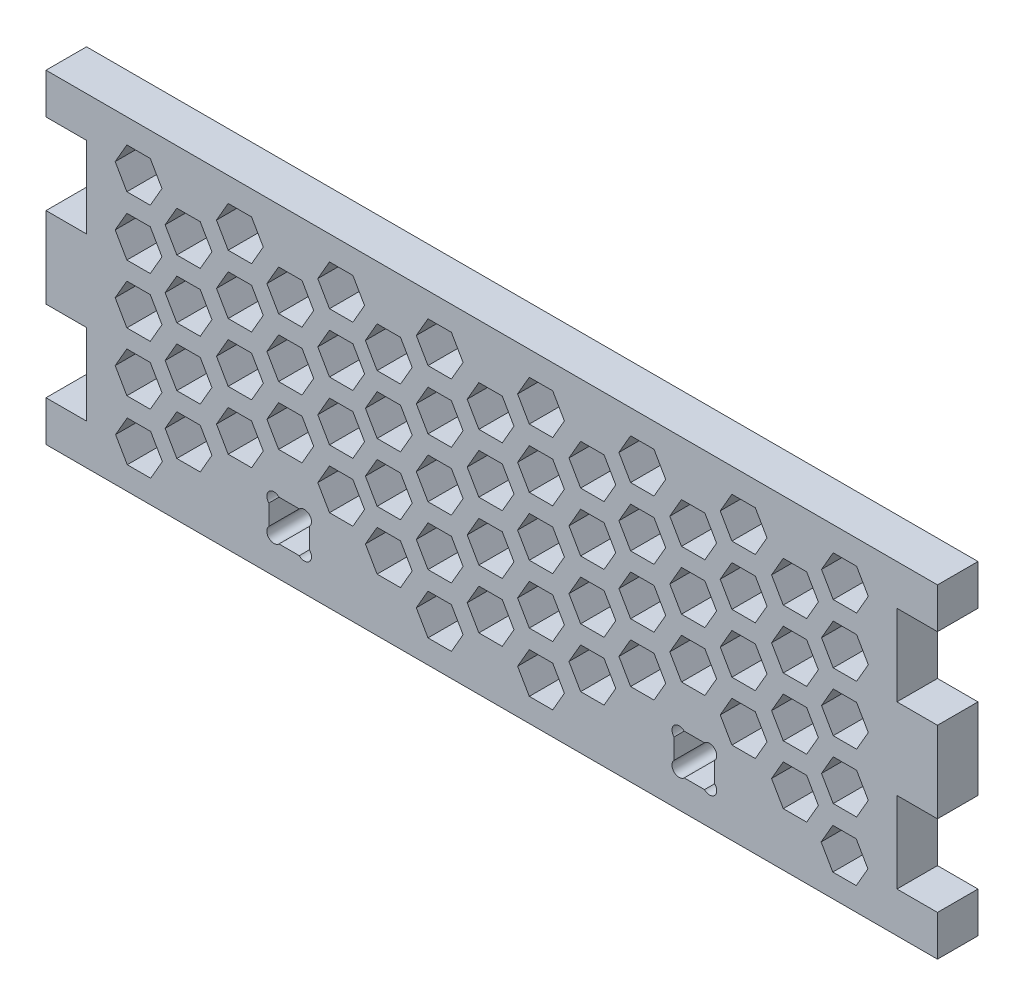
from build123d import *

# Parameters (mm, degrees)
SKETCH2_W                 = 279.4
SKETCH2_H                 = 101.6
RECTANGLE_EXTRUSION_DEPTH = 12.7
SKETCH3_R                 = 2.24536
SKETCH3_W                 = 12.7
SKETCH3_H                 = 12.7
SLOTTING_HOLES_DEPTH      = 12.7
HONEYCOMB_POCKETING_DEPTH = 12.7
SKETCH5_W                 = 12.7
SKETCH5_H                 = 12.7
CUT_EXTRUDE2_DEPTH        = 12.7


with BuildPart() as part:
    # Sketch2 → Rectangle Extrusion (new body)
    with BuildSketch(Plane.XY):
        Rectangle(SKETCH2_W, SKETCH2_H)
    extrude(amount=RECTANGLE_EXTRUSION_DEPTH)

    # Sketch3 → Slotting Holes (cut)
    with BuildSketch(Plane(origin=(0, 0, 0), x_dir=(-1, 0, 0), z_dir=(0, 0, -1))):
        with BuildLine():
            ThreePointArc((-66.674581463, -28.575), (-69.850209282, -28.574790718), (-69.85, -31.750418537))
            Line((-69.85, -31.750418537), (-69.85, -28.575))
            Line((-69.85, -28.575), (-66.674581463, -28.575))
        make_face()
        with BuildLine():
            Line((-69.85, -28.575), (-69.85, -31.750418537))
            ThreePointArc((-69.85, -31.750418537), (-67.403101219, -32.236885515), (-66.01714, -30.1625))
            ThreePointArc((-66.01714, -30.1625), (-66.18800123, -29.303374641), (-66.674581463, -28.575))
            Line((-66.674581463, -28.575), (-69.85, -28.575))
        make_face()
        with Locations((-68.2625, -39.6875)):
            Circle(SKETCH3_R)
        with Locations((-58.7375, -39.6875)):
            Circle(SKETCH3_R)
        with Locations((-58.7375, -30.1625)):
            Circle(SKETCH3_R)
        with Locations((-68.2625, -30.1625)):
            Circle(SKETCH3_R)
        with Locations((-63.5, -34.925)):
            Rectangle(SKETCH3_W, SKETCH3_H)
        with BuildLine():
            ThreePointArc((-60.325418537, -28.575), (-60.325209282, -31.750209282), (-57.15, -31.750418537))
            Line((-57.15, -31.750418537), (-57.15, -28.575))
            Line((-57.15, -28.575), (-60.325418537, -28.575))
        make_face()
        with BuildLine():
            Line((-57.15, -28.575), (-57.15, -31.750418537))
            ThreePointArc((-57.15, -31.750418537), (-56.663114485, -31.021898781), (-56.49214, -30.1625))
            ThreePointArc((-56.49214, -30.1625), (-57.878374641, -28.08800123), (-60.325418537, -28.575))
            Line((-60.325418537, -28.575), (-57.15, -28.575))
        make_face()
        with BuildLine():
            ThreePointArc((-57.15, -38.099581463), (-60.325209282, -38.099790718), (-60.325418537, -41.275))
            Line((-60.325418537, -41.275), (-57.15, -41.275))
            Line((-57.15, -41.275), (-57.15, -38.099581463))
        make_face()
        with BuildLine():
            Line((-57.15, -41.275), (-60.325418537, -41.275))
            ThreePointArc((-60.325418537, -41.275), (-57.878374641, -41.76199877), (-56.49214, -39.6875))
            ThreePointArc((-56.49214, -39.6875), (-56.663114485, -38.828101219), (-57.15, -38.099581463))
            Line((-57.15, -38.099581463), (-57.15, -41.275))
        make_face()
        with BuildLine():
            Line((-69.85, -38.099581463), (-69.85, -41.275))
            Line((-69.85, -41.275), (-66.674581463, -41.275))
            ThreePointArc((-66.674581463, -41.275), (-66.18800123, -40.546625359), (-66.01714, -39.6875))
            ThreePointArc((-66.01714, -39.6875), (-67.403101219, -37.613114485), (-69.85, -38.099581463))
        make_face()
        with BuildLine():
            Line((-66.674581463, -41.275), (-69.85, -41.275))
            Line((-69.85, -41.275), (-69.85, -38.099581463))
            ThreePointArc((-69.85, -38.099581463), (-69.850209282, -41.275209282), (-66.674581463, -41.275))
        make_face()
        with BuildLine():
            ThreePointArc((60.98286, -30.1625), (60.81199877, -29.303374641), (60.325418537, -28.575))
            Line((60.325418537, -28.575), (57.15, -28.575))
            Line((57.15, -28.575), (57.15, -31.750418537))
            ThreePointArc((57.15, -31.750418537), (59.596898781, -32.236885515), (60.98286, -30.1625))
        make_face()
        with BuildLine():
            Line((57.15, -28.575), (60.325418537, -28.575))
            ThreePointArc((60.325418537, -28.575), (57.149790718, -28.574790718), (57.15, -31.750418537))
            Line((57.15, -31.750418537), (57.15, -28.575))
        make_face()
        with Locations((68.2625, -30.1625)):
            Circle(SKETCH3_R)
        with Locations((58.7375, -30.1625)):
            Circle(SKETCH3_R)
        with Locations((58.7375, -39.6875)):
            Circle(SKETCH3_R)
        with Locations((68.2625, -39.6875)):
            Circle(SKETCH3_R)
        with Locations((63.5, -34.925)):
            Rectangle(SKETCH3_W, SKETCH3_H)
        with BuildLine():
            Line((69.85, -31.750418537), (69.85, -28.575))
            Line((69.85, -28.575), (66.674581463, -28.575))
            ThreePointArc((66.674581463, -28.575), (66.674790718, -31.750209282), (69.85, -31.750418537))
        make_face()
        with BuildLine():
            Line((66.674581463, -28.575), (69.85, -28.575))
            Line((69.85, -28.575), (69.85, -31.750418537))
            ThreePointArc((69.85, -31.750418537), (70.336885515, -31.021898781), (70.50786, -30.1625))
            ThreePointArc((70.50786, -30.1625), (69.121625359, -28.08800123), (66.674581463, -28.575))
        make_face()
        with BuildLine():
            ThreePointArc((70.50786, -39.6875), (70.336885515, -38.828101219), (69.85, -38.099581463))
            Line((69.85, -38.099581463), (69.85, -41.275))
            Line((69.85, -41.275), (66.674581463, -41.275))
            ThreePointArc((66.674581463, -41.275), (69.121625359, -41.76199877), (70.50786, -39.6875))
        make_face()
        with BuildLine():
            Line((69.85, -41.275), (69.85, -38.099581463))
            ThreePointArc((69.85, -38.099581463), (66.674790718, -38.099790718), (66.674581463, -41.275))
            Line((66.674581463, -41.275), (69.85, -41.275))
        make_face()
        with BuildLine():
            ThreePointArc((60.98286, -39.6875), (59.596898781, -37.613114485), (57.15, -38.099581463))
            Line((57.15, -38.099581463), (57.15, -41.275))
            Line((57.15, -41.275), (60.325418537, -41.275))
            ThreePointArc((60.325418537, -41.275), (60.81199877, -40.546625359), (60.98286, -39.6875))
        make_face()
        with BuildLine():
            Line((57.15, -41.275), (57.15, -38.099581463))
            ThreePointArc((57.15, -38.099581463), (57.149790718, -41.275209282), (60.325418537, -41.275))
            Line((60.325418537, -41.275), (57.15, -41.275))
        make_face()
    extrude(amount=-SLOTTING_HOLES_DEPTH, mode=Mode.SUBTRACT)

    # Sketch4 → Honeycomb Pocketing (cut)
    with BuildSketch(Plane.XY.offset(12.7)):
        Polygon((6.96765294, 27.501186014), (3.301476978, 33.851185003), (-4.03087144, 33.85118298), (-7.697043898, 27.501181968), (-4.030867936, 21.15118298), (3.301480483, 21.151185003), align=None)
        Polygon((-24.928062682, 27.501186014), (-28.594238643, 33.851185003), (-35.926587062, 33.85118298), (-39.592759519, 27.501181968), (-35.926583558, 21.15118298), (-28.594235139, 21.151185003), align=None)
        Polygon((38.863368561, 27.501186014), (35.1971926, 33.851185003), (27.864844181, 33.85118298), (24.198671724, 27.501181968), (27.864847685, 21.15118298), (35.197196104, 21.151185003), align=None)
        Polygon((-8.980204871, 18.293686014), (-12.646380832, 24.643685003), (-19.978729251, 24.64368298), (-23.644901708, 18.293681968), (-19.978725747, 11.94368298), (-12.646377328, 11.943685003), align=None)
        Polygon((22.769795129, 18.293686014), (19.103619168, 24.643685003), (11.771270749, 24.64368298), (8.105098292, 18.293681968), (11.771274253, 11.94368298), (19.103622672, 11.943685003), align=None)
        Polygon((-24.928062682, 9.086186014), (-28.594238643, 15.436185003), (-35.926587062, 15.43618298), (-39.592759519, 9.086181968), (-35.926583558, 2.73618298), (-28.594235139, 2.736185003), align=None)
        Polygon((6.96765294, 9.086186014), (3.301476978, 15.436185003), (-4.03087144, 15.43618298), (-7.697043898, 9.086181968), (-4.030867936, 2.73618298), (3.301480483, 2.736185003), align=None)
        Polygon((38.863368561, 9.086186014), (35.1971926, 15.436185003), (27.864844181, 15.43618298), (24.198671724, 9.086181968), (27.864847685, 2.73618298), (35.197196104, 2.736185003), align=None)
        Polygon((-24.928062682, -9.328813986), (-28.594238643, -2.978814997), (-35.926587062, -2.97881702), (-39.592759519, -9.328818032), (-35.926583558, -15.67881702), (-28.594235139, -15.678814997), align=None)
        Polygon((-8.980204871, -18.536313986), (-12.646380832, -12.186314997), (-19.978729251, -12.18631702), (-23.644901708, -18.536318032), (-19.978725747, -24.88631702), (-12.646377328, -24.886314997), align=None)
        Polygon((6.96765294, -9.328813986), (3.301476978, -2.978814997), (-4.03087144, -2.97881702), (-7.697043898, -9.328818032), (-4.030867936, -15.67881702), (3.301480483, -15.678814997), align=None)
        Polygon((22.769795129, -18.536313986), (19.103619168, -12.186314997), (11.771270749, -12.18631702), (8.105098292, -18.536318032), (11.771274253, -24.88631702), (19.103622672, -24.886314997), align=None)
        Polygon((38.863368561, -9.328813986), (35.1971926, -2.978814997), (27.864844181, -2.97881702), (24.198671724, -9.328818032), (27.864847685, -15.67881702), (35.197196104, -15.678814997), align=None)
        Polygon((38.863368561, -27.743813986), (35.1971926, -21.393814997), (27.864844181, -21.39381702), (24.198671724, -27.743818032), (27.864847685, -34.09381702), (35.197196104, -34.093814997), align=None)
        Polygon((6.96765294, -27.743813986), (3.301476978, -21.393814997), (-4.03087144, -21.39381702), (-7.697043898, -27.743818032), (-4.030867936, -34.09381702), (3.301480483, -34.093814997), align=None)
        Polygon((-24.928062682, -27.743813986), (-28.594238643, -21.393814997), (-35.926587062, -21.39381702), (-39.592759519, -27.743818032), (-35.926583558, -34.09381702), (-28.594235139, -34.093814997), align=None)
        Polygon((22.769795129, -0.121313986), (19.103619168, 6.228685003), (11.771270749, 6.22868298), (8.105098292, -0.121318032), (11.771274253, -6.47131702), (19.103622672, -6.471314997), align=None)
        Polygon((-8.980204871, -0.121313986), (-12.646380832, 6.228685003), (-19.978729251, 6.22868298), (-23.644901708, -0.121318032), (-19.978725747, -6.47131702), (-12.646377328, -6.471314997), align=None)
        Polygon((-8.980204871, -37.078313986), (-12.646380832, -30.728314997), (-19.978729251, -30.72831702), (-23.644901708, -37.078318032), (-19.978725747, -43.42831702), (-12.646377328, -43.428314997), align=None)
        Polygon((22.769795129, -37.078313986), (19.103619168, -30.728314997), (11.771270749, -30.72831702), (8.105098292, -37.078318032), (11.771274253, -43.42831702), (19.103622672, -43.428314997), align=None)
        Polygon((-8.980204871, 36.835686014), (-12.646380832, 43.185685003), (-19.978729251, 43.18568298), (-23.644901708, 36.835681968), (-19.978725747, 30.48568298), (-12.646377328, 30.485685003), align=None)
        Polygon((22.769795129, 36.835686014), (19.103619168, 43.185685003), (11.771270749, 43.18568298), (8.105098292, 36.835681968), (11.771274253, 30.48568298), (19.103622672, 30.485685003), align=None)
        Polygon((70.46765294, 27.501188038), (66.801476978, 33.851187026), (59.46912856, 33.851185003), (55.802956102, 27.501183991), (59.469132064, 21.151185003), (66.801480483, 21.151187026), align=None)
        Polygon((102.363368561, 27.501188038), (98.6971926, 33.851187026), (91.364844181, 33.851185003), (87.698671724, 27.501183991), (91.364847685, 21.151185003), (98.697196104, 21.151187026), align=None)
        Polygon((54.519795129, 18.293688038), (50.853619168, 24.643687026), (43.521270749, 24.643685003), (39.855098292, 18.293683991), (43.521274253, 11.943685003), (50.853622672, 11.943687026), align=None)
        Polygon((86.269795129, 18.293688038), (82.603619168, 24.643687026), (75.271270749, 24.643685003), (71.605098292, 18.293683991), (75.271274253, 11.943685003), (82.603622672, 11.943687026), align=None)
        Polygon((70.46765294, 9.086188038), (66.801476978, 15.436187026), (59.46912856, 15.436185003), (55.802956102, 9.086183991), (59.469132064, 2.736185003), (66.801480483, 2.736187026), align=None)
        Polygon((102.363368561, 9.086188038), (98.6971926, 15.436187026), (91.364844181, 15.436185003), (87.698671724, 9.086183991), (91.364847685, 2.736185003), (98.697196104, 2.736187026), align=None)
        Polygon((54.519795129, -18.536311962), (50.853619168, -12.186312974), (43.521270749, -12.186314997), (39.855098292, -18.536316009), (43.521274253, -24.886314997), (50.853622672, -24.886312974), align=None)
        Polygon((70.46765294, -9.328811962), (66.801476978, -2.978812974), (59.46912856, -2.978814997), (55.802956102, -9.328816009), (59.469132064, -15.678814997), (66.801480483, -15.678812974), align=None)
        Polygon((86.269795129, -18.536311962), (82.603619168, -12.186312974), (75.271270749, -12.186314997), (71.605098292, -18.536316009), (75.271274253, -24.886314997), (82.603622672, -24.886312974), align=None)
        Polygon((102.363368561, -9.328811962), (98.6971926, -2.978812974), (91.364844181, -2.978814997), (87.698671724, -9.328816009), (91.364847685, -15.678814997), (98.697196104, -15.678812974), align=None)
        Polygon((102.363368561, -27.743811962), (98.6971926, -21.393812974), (91.364844181, -21.393814997), (87.698671724, -27.743816009), (91.364847685, -34.093814997), (98.697196104, -34.093812974), align=None)
        Polygon((86.269795129, -0.121311962), (82.603619168, 6.228687026), (75.271270749, 6.228685003), (71.605098292, -0.121316009), (75.271274253, -6.471314997), (82.603622672, -6.471312974), align=None)
        Polygon((54.519795129, -0.121311962), (50.853619168, 6.228687026), (43.521270749, 6.228685003), (39.855098292, -0.121316009), (43.521274253, -6.471314997), (50.853622672, -6.471312974), align=None)
        Polygon((54.519795129, 36.835688038), (50.853619168, 43.185687026), (43.521270749, 43.185685003), (39.855098292, 36.835683991), (43.521274253, 30.485685003), (50.853622672, 30.485687026), align=None)
        Polygon((86.269795129, 36.835688038), (82.603619168, 43.185687026), (75.271270749, 43.185685003), (71.605098292, 36.835683991), (75.271274253, 30.485685003), (82.603622672, 30.485687026), align=None)
        Polygon((118.019795129, 36.835688038), (114.353619168, 43.185687026), (107.021270749, 43.185685003), (103.355098292, 36.835683991), (107.021274253, 30.485685003), (114.353622672, 30.485687026), align=None)
        Polygon((118.019795129, 18.293688038), (114.353619168, 24.643687026), (107.021270749, 24.643685003), (103.355098292, 18.293683991), (107.021274253, 11.943685003), (114.353622672, 11.943687026), align=None)
        Polygon((118.019795129, -0.121311962), (114.353619168, 6.228687026), (107.021270749, 6.228685003), (103.355098292, -0.121316009), (107.021274253, -6.471314997), (114.353622672, -6.471312974), align=None)
        Polygon((118.019795129, -18.536311962), (114.353619168, -12.186312974), (107.021270749, -12.186314997), (103.355098292, -18.536316009), (107.021274253, -24.886314997), (114.353622672, -24.886312974), align=None)
        Polygon((117.895930366, -37.202176726), (114.229754405, -30.852177737), (106.897405986, -30.85217976), (103.231233529, -37.202180772), (106.89740949, -43.55217976), (114.229757909, -43.552177737), align=None)
        Polygon((-114.229757909, -43.552177737), (-117.895930366, -37.202176726), (-114.229754405, -30.852177737), (-106.897405986, -30.85217976), (-103.231233529, -37.202180772), (-106.89740949, -43.55217976), align=None)
        Polygon((-114.353622672, -24.886312974), (-118.019795129, -18.536311962), (-114.353619168, -12.186312974), (-107.021270749, -12.186314997), (-103.355098292, -18.536316009), (-107.021274253, -24.886314997), align=None)
        Polygon((-114.353622672, -6.471312974), (-118.019795129, -0.121311962), (-114.353619168, 6.228687026), (-107.021270749, 6.228685003), (-103.355098292, -0.121316009), (-107.021274253, -6.471314997), align=None)
        Polygon((-114.353622672, 11.943687026), (-118.019795129, 18.293688038), (-114.353619168, 24.643687026), (-107.021270749, 24.643685003), (-103.355098292, 18.293683991), (-107.021274253, 11.943685003), align=None)
        Polygon((-114.353622672, 30.485687026), (-118.019795129, 36.835688038), (-114.353619168, 43.185687026), (-107.021270749, 43.185685003), (-103.355098292, 36.835683991), (-107.021274253, 30.485685003), align=None)
        Polygon((-82.603622672, 30.485687026), (-86.269795129, 36.835688038), (-82.603619168, 43.185687026), (-75.271270749, 43.185685003), (-71.605098292, 36.835683991), (-75.271274253, 30.485685003), align=None)
        Polygon((-50.853622672, 30.485687026), (-54.519795129, 36.835688038), (-50.853619168, 43.185687026), (-43.521270749, 43.185685003), (-39.855098292, 36.835683991), (-43.521274253, 30.485685003), align=None)
        Polygon((-50.853622672, -6.471312974), (-54.519795129, -0.121311962), (-50.853619168, 6.228687026), (-43.521270749, 6.228685003), (-39.855098292, -0.121316009), (-43.521274253, -6.471314997), align=None)
        Polygon((-82.603622672, -6.471312974), (-86.269795129, -0.121311962), (-82.603619168, 6.228687026), (-75.271270749, 6.228685003), (-71.605098292, -0.121316009), (-75.271274253, -6.471314997), align=None)
        Polygon((-98.697196104, -34.093812974), (-102.363368561, -27.743811962), (-98.6971926, -21.393812974), (-91.364844181, -21.393814997), (-87.698671724, -27.743816009), (-91.364847685, -34.093814997), align=None)
        Polygon((-98.697196104, -15.678812974), (-102.363368561, -9.328811962), (-98.6971926, -2.978812974), (-91.364844181, -2.978814997), (-87.698671724, -9.328816009), (-91.364847685, -15.678814997), align=None)
        Polygon((-82.603622672, -24.886312974), (-86.269795129, -18.536311962), (-82.603619168, -12.186312974), (-75.271270749, -12.186314997), (-71.605098292, -18.536316009), (-75.271274253, -24.886314997), align=None)
        Polygon((-66.801480483, -15.678812974), (-70.46765294, -9.328811962), (-66.801476978, -2.978812974), (-59.46912856, -2.978814997), (-55.802956102, -9.328816009), (-59.469132064, -15.678814997), align=None)
        Polygon((-50.853622672, -24.886312974), (-54.519795129, -18.536311962), (-50.853619168, -12.186312974), (-43.521270749, -12.186314997), (-39.855098292, -18.536316009), (-43.521274253, -24.886314997), align=None)
        Polygon((-98.697196104, 2.736187026), (-102.363368561, 9.086188038), (-98.6971926, 15.436187026), (-91.364844181, 15.436185003), (-87.698671724, 9.086183991), (-91.364847685, 2.736185003), align=None)
        Polygon((-66.801480483, 2.736187026), (-70.46765294, 9.086188038), (-66.801476978, 15.436187026), (-59.46912856, 15.436185003), (-55.802956102, 9.086183991), (-59.469132064, 2.736185003), align=None)
        Polygon((-82.603622672, 11.943687026), (-86.269795129, 18.293688038), (-82.603619168, 24.643687026), (-75.271270749, 24.643685003), (-71.605098292, 18.293683991), (-75.271274253, 11.943685003), align=None)
        Polygon((-50.853622672, 11.943687026), (-54.519795129, 18.293688038), (-50.853619168, 24.643687026), (-43.521270749, 24.643685003), (-39.855098292, 18.293683991), (-43.521274253, 11.943685003), align=None)
        Polygon((-98.697196104, 21.151187026), (-102.363368561, 27.501188038), (-98.6971926, 33.851187026), (-91.364844181, 33.851185003), (-87.698671724, 27.501183991), (-91.364847685, 21.151185003), align=None)
        Polygon((-66.801480483, 21.151187026), (-70.46765294, 27.501188038), (-66.801476978, 33.851187026), (-59.46912856, 33.851185003), (-55.802956102, 27.501183991), (-59.469132064, 21.151185003), align=None)
    extrude(amount=-HONEYCOMB_POCKETING_DEPTH, mode=Mode.SUBTRACT)

    # Sketch5 → Cut-Extrude2 (cut)
    with BuildSketch(Plane.XY.offset(12.7)):
        with Locations((-133.35, 31.75)):
            Rectangle(SKETCH5_W, SKETCH5_H)
        with Locations((-133.35, 19.05)):
            Rectangle(SKETCH5_W, SKETCH5_H)
        with Locations((-133.35, -19.05)):
            Rectangle(SKETCH5_W, SKETCH5_H)
        with Locations((-133.35, -31.75)):
            Rectangle(SKETCH5_W, SKETCH5_H)
        with Locations((133.35, -19.05)):
            Rectangle(SKETCH5_W, SKETCH5_H)
        with Locations((133.35, -31.75)):
            Rectangle(SKETCH5_W, SKETCH5_H)
        with Locations((133.35, 31.75)):
            Rectangle(SKETCH5_W, SKETCH5_H)
        with Locations((133.35, 19.05)):
            Rectangle(SKETCH5_W, SKETCH5_H)
    extrude(amount=-CUT_EXTRUDE2_DEPTH, mode=Mode.SUBTRACT)


solid = part.part
